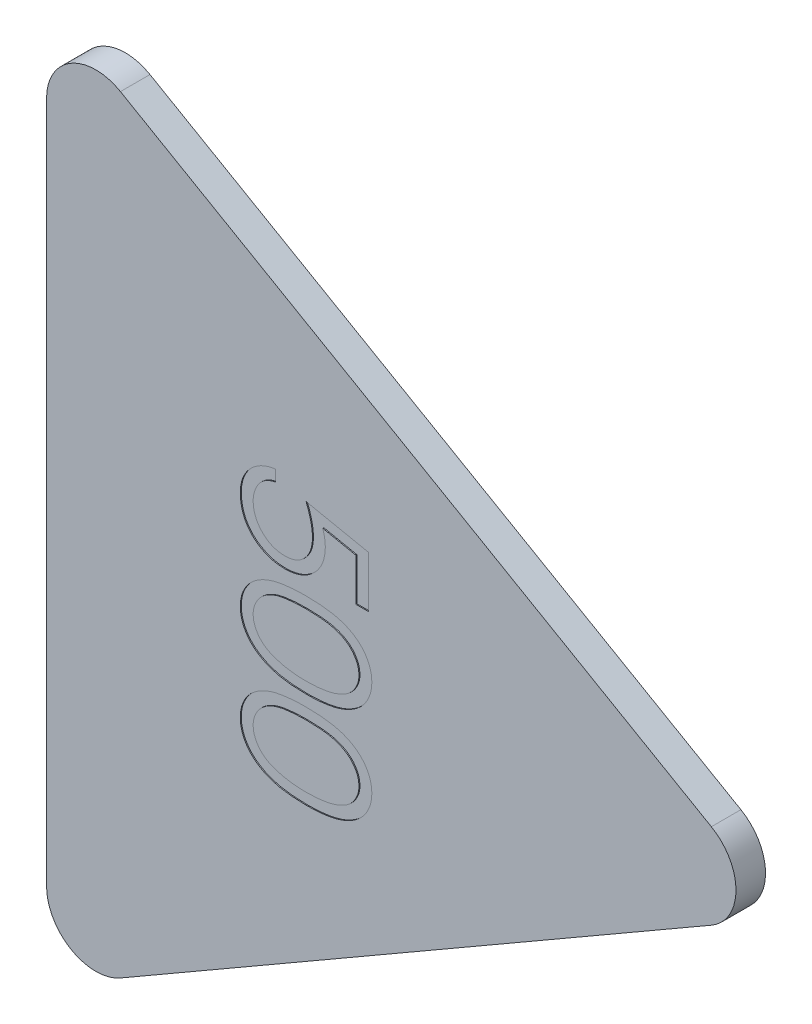
from build123d import *

# Parameters (mm, degrees)
BOSS_EXTRUDE1_DEPTH = 3
CUT_EXTRUDE1_DEPTH  = 0.1


with BuildPart() as part:
    # Sketch1 → Boss-Extrude1 (new body)
    with BuildSketch(Plane(origin=(0, 0, 0), x_dir=(0, 1, 0), z_dir=(0, 0, 1))):
        with BuildLine():
            Line((4.330127019, -42.5), (38.97114317, 17.5))
            ThreePointArc((38.97114317, 17.5), (38.97114317, 22.5), (34.641016151, 25))
            Line((34.641016151, 25), (-34.641016151, 25))
            ThreePointArc((-34.641016151, 25), (-38.97114317, 22.5), (-38.97114317, 17.5))
            Line((-38.97114317, 17.5), (-4.330127019, -42.5))
            ThreePointArc((-4.330127019, -42.5), (0, -45), (4.330127019, -42.5))
        make_face()
    extrude(amount=BOSS_EXTRUDE1_DEPTH)

    # Sketch3 → Cut-Extrude1 (cut)
    # profile 1 of 3: a face of its own
    with BuildSketch(Plane(origin=(0, 0, 3), x_dir=(0, -1, 0), z_dir=(0, 0, 1))):
        with BuildLine():
            Line((-5.840961891, 7.698344684), (-5.840961891, 6.395780582))
            Line((-5.840961891, 6.395780582), (-10.158249551, 6.395780582))
            Line((-10.158249551, 6.395780582), (-10.845148589, 3.055415998))
            add(Edge.make_bspline(
                [(-10.845148589, 3.055415998), (-10.710688702, 3.09253727), (-10.450193938, 3.164453864), (-10.065711013, 3.244303374), (-9.700705018, 3.292437985), (-9.463848674, 3.299010454), (-9.349235128, 3.302190838)],
                knots=[0, 0, 0, 0, 1.100273476, 2.13160584, 3.095893838, 4, 4, 4, 4], degree=3))
            add(Edge.make_bspline(
                [(-9.349235128, 3.302190838), (-9.207416987, 3.2991213), (-8.928567088, 3.293085821), (-8.520574337, 3.235130825), (-8.131109268, 3.143908849), (-7.760986382, 3.016471527), (-7.409520955, 2.853513352), (-7.07994666, 2.649950712), (-6.767316519, 2.412158338), (-6.477239107, 2.138763581), (-6.214079474, 1.837876571), (-5.982700026, 1.514360868), (-5.786167198, 1.171360494), (-5.628103888, 0.805598285), (-5.501886446, 0.421117928), (-5.417877779, 0.013873986), (-5.36193715, -0.412294907), (-5.355687348, -0.703685775), (-5.352500352, -0.852276309)],
                knots=[0, 0, 0, 0, 1.052922333, 2.070308379, 3.05430497, 4.020497103, 4.973039431, 5.925935799, 6.892292201, 7.88610001, 8.88166317, 9.857072816, 10.836096531, 11.812156883, 12.81219415, 13.836441305, 14.89672472, 16, 16, 16, 16], degree=3))
            add(Edge.make_bspline(
                [(-5.352500352, -0.852276309), (-5.354913625, -0.955771223), (-5.359707558, -1.161362407), (-5.384086434, -1.466685649), (-5.431024603, -1.765545072), (-5.494044631, -2.057980322), (-5.575841404, -2.343437759), (-5.674861686, -2.622734446), (-5.796041557, -2.894132019), (-5.928961119, -3.160198452), (-6.07862691, -3.41491875), (-6.244737494, -3.653130787), (-6.420235134, -3.878408036), (-6.609071018, -4.088334439), (-6.813000343, -4.281530533), (-7.029553366, -4.459142868), (-7.257002089, -4.624175124), (-7.498865397, -4.769928289), (-7.749753835, -4.904051016), (-8.013290509, -5.014082137), (-8.283476479, -5.112454625), (-8.564200456, -5.190866339), (-8.854826576, -5.252307323), (-9.155833904, -5.294038074), (-9.465643764, -5.324432575), (-9.675647381, -5.326335242), (-9.781727115, -5.327296341)],
                knots=[0, 0, 0, 0, 1.056347294, 2.098418968, 3.122841568, 4.141288669, 5.149314143, 6.15115421, 7.162517403, 8.180376062, 9.185164535, 10.17417709, 11.141909838, 12.097768115, 13.052685741, 14.0056014, 14.954263652, 15.917497458, 16.885230207, 17.854509472, 18.828990115, 19.81800267, 20.826176721, 21.857883937, 22.917946725, 24, 24, 24, 24], degree=3))
            add(Edge.make_bspline(
                [(-9.781727115, -5.327296341), (-9.908270571, -5.324789586), (-10.157229871, -5.319857842), (-10.521975928, -5.268265053), (-10.872911783, -5.194373128), (-11.207212436, -5.083207234), (-11.527873879, -4.943916193), (-11.830579169, -4.7678718), (-12.123062985, -4.568376195), (-12.393435233, -4.3329532), (-12.64437313, -4.075630582), (-12.869005319, -3.796384284), (-13.069061441, -3.499823166), (-13.241337837, -3.184507007), (-13.3882878, -2.851264337), (-13.503730757, -2.498846591), (-13.596906502, -2.129095148), (-13.6363252, -1.874538125), (-13.656346506, -1.745245059)],
                knots=[0, 0, 0, 0, 1.0467383, 2.05933395, 3.04377827, 4.011590433, 4.970194871, 5.932262533, 6.905835911, 7.896367577, 8.894135286, 9.877477877, 10.858688626, 11.851381753, 12.8477658, 13.868841284, 14.917554742, 16, 16, 16, 16], degree=3))
            Line((-13.656346506, -1.745245059), (-12.516602916, -1.745245059))
            add(Edge.make_bspline(
                [(-12.516602916, -1.745245059), (-12.488559294, -1.866353901), (-12.434657894, -2.09913182), (-12.316345606, -2.42617983), (-12.171689429, -2.71762387), (-11.999679365, -2.977319215), (-11.79448354, -3.203774719), (-11.560333898, -3.405585201), (-11.297815016, -3.587649242), (-11.006102441, -3.73940614), (-10.698352124, -3.868832759), (-10.376253962, -3.955017481), (-10.048578191, -4.015617864), (-9.826950962, -4.021683967), (-9.715581282, -4.024732239)],
                knots=[0, 0, 0, 0, 1.136247022, 2.183929868, 3.172523383, 4.106158343, 5.02341133, 5.958108904, 6.928429099, 7.938127109, 8.96079061, 9.975095812, 10.982467395, 12, 12, 12, 12], degree=3))
            add(Edge.make_bspline(
                [(-9.715581282, -4.024732239), (-9.606874926, -4.021753988), (-9.392831223, -4.015889786), (-9.077829905, -3.970753943), (-8.773708905, -3.901239327), (-8.483469067, -3.79720871), (-8.202031481, -3.67077216), (-7.936515228, -3.508520314), (-7.679239074, -3.321793961), (-7.438199847, -3.107865618), (-7.217439559, -2.87211844), (-7.022381634, -2.620014756), (-6.859905405, -2.351076484), (-6.722984496, -2.069959615), (-6.619013955, -1.773583136), (-6.544842394, -1.463336015), (-6.501288438, -1.138451944), (-6.495297013, -0.916857591), (-6.492243942, -0.80393897)],
                knots=[0, 0, 0, 0, 1.027316725, 2.022795036, 3.002884548, 3.971462791, 4.93288096, 5.914575861, 6.907176829, 7.935150275, 8.956128384, 9.956726525, 10.942570165, 11.921478529, 12.907843606, 13.90538589, 14.932640048, 16, 16, 16, 16], degree=3))
            add(Edge.make_bspline(
                [(-6.492243942, -0.80393897), (-6.494633282, -0.702064099), (-6.499310074, -0.502658536), (-6.537521001, -0.210924273), (-6.603985443, 0.065112195), (-6.696237808, 0.326783844), (-6.813366307, 0.574337478), (-6.956500069, 0.808028582), (-7.128325256, 1.024777062), (-7.324601537, 1.224684328), (-7.539623572, 1.409178588), (-7.777090866, 1.566455702), (-8.032034029, 1.698767632), (-8.301381433, 1.812951512), (-8.591539779, 1.894959931), (-8.896762988, 1.956529115), (-9.220347043, 1.99214486), (-9.44158354, 1.997086569), (-9.555304839, 1.999626736)],
                knots=[0, 0, 0, 0, 1.045622112, 2.046656509, 3.013763289, 3.955457236, 4.890082067, 5.820317437, 6.762574623, 7.722996705, 8.69280354, 9.665887285, 10.63943826, 11.638615906, 12.663482002, 13.728887084, 14.832589034, 16, 16, 16, 16], degree=3))
            add(Edge.make_bspline(
                [(-9.555304839, 1.999626736), (-9.653744095, 1.997520019), (-9.856996185, 1.993170184), (-10.168773299, 1.96114261), (-10.496403265, 1.909474313), (-10.838630149, 1.838404215), (-11.196481707, 1.745400022), (-11.569202761, 1.633950263), (-11.957576985, 1.500701867), (-12.2192613, 1.400073549), (-12.353782404, 1.348344684)],
                knots=[0, 0, 0, 0, 0.817624296, 1.688186739, 2.600797293, 3.572016777, 4.590301741, 5.671205678, 6.80286297, 8, 8, 8, 8], degree=3))
            Line((-12.353782404, 1.348344684), (-11.051218301, 7.698344684))
            Line((-11.051218301, 7.698344684), (-5.840961891, 7.698344684))
        make_face()
    # profile 2 of 3: a face of its own
    with BuildSketch(Plane(origin=(0, 0, 3), x_dir=(0, -1, 0), z_dir=(0, 0, 1))):
        with BuildLine():
            add(Edge.make_bspline(
                [(-4.04993625, 1.343256543), (-4.048746012, 1.546809922), (-4.046433959, 1.942215293), (-4.020713118, 2.518376708), (-3.977985447, 3.058889757), (-3.919429837, 3.563780311), (-3.848172023, 4.033178714), (-3.753047257, 4.465830547), (-3.644869373, 4.863738262), (-3.519493356, 5.22819941), (-3.378023378, 5.564124218), (-3.224047632, 5.877724234), (-3.051455378, 6.16852496), (-2.87011058, 6.441167799), (-2.672672492, 6.691189777), (-2.464759738, 6.922121724), (-2.238257501, 7.128626447), (-2.000865442, 7.316754459), (-1.750434271, 7.481671113), (-1.494102311, 7.626932765), (-1.230105213, 7.751029426), (-0.957722206, 7.848603293), (-0.679401496, 7.929196937), (-0.39417014, 7.984311119), (-0.101557191, 8.018989044), (0.095951158, 8.022304352), (0.196117436, 8.02398571)],
                knots=[0, 0, 0, 0, 1.646270934, 3.197905019, 4.663502075, 6.030701355, 7.308322542, 8.50163776, 9.611534131, 10.641858119, 11.616356847, 12.558055219, 13.465016945, 14.349605745, 15.204443733, 16.039544428, 16.859896111, 17.680448484, 18.487036065, 19.28249412, 20.06191084, 20.843045899, 21.620316918, 22.403196591, 23.190181807, 24, 24, 24, 24], degree=3))
            add(Edge.make_bspline(
                [(0.196117436, 8.02398571), (0.297120458, 8.022215638), (0.49798369, 8.018695521), (0.794947338, 7.984862929), (1.085050469, 7.928724854), (1.367056286, 7.849183032), (1.643281237, 7.750501577), (1.911564773, 7.626814038), (2.173573327, 7.482836433), (2.425143227, 7.313658364), (2.66903626, 7.125036962), (2.899261726, 6.911812421), (3.11584058, 6.676137725), (3.321490974, 6.420534391), (3.510378427, 6.14009994), (3.690259167, 5.839711884), (3.851266268, 5.514117032), (4.00633209, 5.168747906), (4.140179156, 4.794048344), (4.260888103, 4.392130499), (4.35842036, 3.958247021), (4.439661434, 3.494674359), (4.502598628, 2.999710063), (4.548437072, 2.474415147), (4.572650838, 1.918444015), (4.577210868, 1.538322676), (4.57955093, 1.343256543)],
                knots=[0, 0, 0, 0, 0.810914788, 1.612654377, 2.396697861, 3.181598691, 3.963628158, 4.749916497, 5.551656086, 6.361998678, 7.18212741, 8.025565596, 8.878627764, 9.750805457, 10.657531673, 11.591944965, 12.560506719, 13.57287815, 14.630710178, 15.753379473, 16.941251878, 18.199788006, 19.531962791, 20.947069417, 22.433333509, 24, 24, 24, 24], degree=3))
            add(Edge.make_bspline(
                [(4.57955093, 1.343256543), (4.577186609, 1.14904122), (4.572579826, 0.770620583), (4.548708518, 0.217151044), (4.501687199, -0.305356141), (4.442868099, -0.798154105), (4.361403176, -1.259191751), (4.261235859, -1.690064464), (4.150018973, -2.092632952), (4.01273272, -2.463599269), (3.862471, -2.808138377), (3.698985002, -3.129873458), (3.52383449, -3.431648292), (3.333012473, -3.711047374), (3.129618659, -3.970049929), (2.909299825, -4.20408416), (2.678266559, -4.41878917), (2.433655793, -4.609839361), (2.17816245, -4.777061366), (1.9170538, -4.926608766), (1.645696952, -5.047195974), (1.37024138, -5.150737408), (1.086747023, -5.229841905), (0.795567263, -5.284538467), (0.498183207, -5.322899174), (0.297154671, -5.325825544), (0.196117436, -5.327296341)],
                knots=[0, 0, 0, 0, 1.561518951, 3.042555995, 4.452378317, 5.7783523, 7.031515105, 8.214008947, 9.334062868, 10.386615937, 11.391082383, 12.354592575, 13.286541444, 14.194233754, 15.072674879, 15.931287219, 16.775624067, 17.606195743, 18.42308326, 19.229000347, 20.022332153, 20.807536673, 21.593273796, 22.3848459, 23.188221202, 24, 24, 24, 24], degree=3))
            add(Edge.make_bspline(
                [(0.196117436, -5.327296341), (0.095953937, -5.325604137), (-0.101548933, -5.322267441), (-0.39420202, -5.287746187), (-0.678255457, -5.232245361), (-0.955110936, -5.154533683), (-1.226188862, -5.059411277), (-1.487795388, -4.935482197), (-1.742839269, -4.792755718), (-1.990640058, -4.630212332), (-2.226541328, -4.443987938), (-2.451870553, -4.238014662), (-2.660967051, -4.00715257), (-2.855582198, -3.755046963), (-3.040545318, -3.484017198), (-3.210686758, -3.190362816), (-3.368061, -2.875248201), (-3.511910238, -2.536637496), (-3.639449674, -2.169589615), (-3.7521085, -1.769905453), (-3.841059872, -1.334057288), (-3.917198024, -0.865545699), (-3.978609357, -0.362357437), (-4.020535051, 0.175780672), (-4.046447823, 0.748533288), (-4.048752222, 1.141397897), (-4.04993625, 1.343256543)],
                knots=[0, 0, 0, 0, 0.810891512, 1.598919785, 2.382837074, 3.152667961, 3.926044502, 4.706494248, 5.493654104, 6.291793342, 7.103789334, 7.925228297, 8.761435821, 9.622817696, 10.50288917, 11.416980706, 12.369136599, 13.353924996, 14.394355917, 15.514179734, 16.714354668, 17.994756427, 19.357759367, 20.818452758, 22.365282078, 24, 24, 24, 24], degree=3))
        make_face()
        with BuildLine():
            add(Edge.make_bspline(
                [(-2.91019266, 1.348344684), (-2.909759238, 1.178713691), (-2.90891805, 0.849493243), (-2.886942694, 0.371090553), (-2.857006138, -0.075116068), (-2.818393431, -0.489693186), (-2.761051303, -0.871237517), (-2.696800959, -1.222373225), (-2.618612177, -1.541242056), (-2.526101683, -1.830032112), (-2.420731246, -2.093644447), (-2.305684255, -2.338940284), (-2.182092489, -2.568817311), (-2.043774428, -2.78121069), (-1.893134056, -2.976813057), (-1.733573944, -3.159086477), (-1.559139139, -3.321635523), (-1.317825559, -3.516587254), (-0.99924978, -3.718042397), (-0.597855557, -3.893469637), (-0.185401463, -4.00371455), (0.094547359, -4.017734465), (0.234278494, -4.024732239)],
                knots=[0, 0, 0, 0, 1.459021318, 2.831673884, 4.118529203, 5.306027144, 6.411944654, 7.436330062, 8.375795394, 9.233974572, 10.042671642, 10.816086306, 11.563610507, 12.285937304, 12.993564865, 13.685989202, 14.367179055, 15.041617293, 16.353048772, 17.594441528, 18.799311195, 20, 20, 20, 20], degree=3))
            add(Edge.make_bspline(
                [(0.234278494, -4.024732239), (0.374913474, -4.018934577), (0.655893075, -4.007351223), (1.066407132, -3.895595805), (1.464934112, -3.726977762), (1.777252295, -3.527596814), (2.014860382, -3.337719732), (2.185102031, -3.175832294), (2.34135575, -2.994563861), (2.489554136, -2.798986416), (2.625477068, -2.585363402), (2.749077596, -2.354722058), (2.861865743, -2.106421898), (2.926124281, -1.933085987), (2.958978013, -1.844463809)],
                knots=[0, 0, 0, 0, 1.353760809, 2.704726607, 4.075137775, 5.516104923, 6.260822281, 7.007110065, 7.778089737, 8.566572457, 9.372053459, 10.217411131, 11.088608312, 12, 12, 12, 12], degree=3))
            add(Edge.make_bspline(
                [(2.958978013, -1.844463809), (2.997265856, -1.731144469), (3.075006598, -1.50105761), (3.175197893, -1.144138073), (3.254102627, -0.769659472), (3.325089697, -0.379859763), (3.373542214, 0.028135724), (3.412541423, 0.453064603), (3.435512772, 0.89524726), (3.438360298, 1.195674799), (3.43980734, 1.348344684)],
                knots=[0, 0, 0, 0, 0.884706709, 1.796334032, 2.740027952, 3.714592787, 4.726048262, 5.777819803, 6.87074269, 8, 8, 8, 8], degree=3))
            add(Edge.make_bspline(
                [(3.43980734, 1.348344684), (3.437810939, 1.500989876), (3.433905552, 1.799596502), (3.418977654, 2.236905329), (3.380429255, 2.652259776), (3.337615309, 3.047449206), (3.27448825, 3.420286018), (3.206424208, 3.773891412), (3.114979809, 4.103884673), (3.017299483, 4.415432298), (2.905501762, 4.704994673), (2.782436097, 4.973921841), (2.651002859, 5.223512128), (2.508246729, 5.453080744), (2.355862393, 5.663655971), (2.189827858, 5.851015786), (2.016729133, 6.02096707), (1.774278202, 6.214959821), (1.456871493, 6.412759402), (1.061917287, 6.594789445), (0.650906664, 6.699322392), (0.373054416, 6.714060514), (0.234278494, 6.721421607)],
                knots=[0, 0, 0, 0, 1.31362396, 2.569729283, 3.763502607, 4.902122613, 5.988968491, 7.01645872, 7.998833611, 8.933434873, 9.825090667, 10.667526885, 11.477055099, 12.250526234, 12.991942729, 13.710640831, 14.402115721, 15.076753259, 16.378508321, 17.609869233, 18.806226677, 20, 20, 20, 20], degree=3))
            add(Edge.make_bspline(
                [(0.234278494, 6.721421607), (0.093814345, 6.714050358), (-0.187369843, 6.699294431), (-0.602652422, 6.595178911), (-1.000722498, 6.413703291), (-1.317289863, 6.214304683), (-1.559909889, 6.024391381), (-1.730752805, 5.859703391), (-1.890940344, 5.679558411), (-2.038505998, 5.482157177), (-2.176715683, 5.270011415), (-2.303646786, 5.041452183), (-2.418009668, 4.795321233), (-2.523544985, 4.53182731), (-2.616337673, 4.243062169), (-2.692878625, 3.924586107), (-2.763588789, 3.574567242), (-2.813645908, 3.190956456), (-2.858145822, 2.7762755), (-2.886743856, 2.328954945), (-2.908991561, 1.849749908), (-2.909784275, 1.518827247), (-2.91019266, 1.348344684)],
                knots=[0, 0, 0, 0, 1.207732386, 2.417664972, 3.655092373, 4.956220595, 5.625982001, 6.301752483, 6.994047911, 7.697131622, 8.419323945, 9.170223765, 9.943494443, 10.752040957, 11.610060368, 12.549350801, 13.567764191, 14.679664412, 15.874934091, 17.154273443, 18.533957287, 20, 20, 20, 20], degree=3))
        make_face(mode=Mode.SUBTRACT)
    # profile 3 of 3: a face of its own
    with BuildSketch(Plane(origin=(0, 0, 3), x_dir=(0, -1, 0), z_dir=(0, 0, 1))):
        with BuildLine():
            add(Edge.make_bspline(
                [(5.71929452, 1.343256543), (5.720484757, 1.546809922), (5.72279681, 1.942215293), (5.748517652, 2.518376708), (5.791245322, 3.058889757), (5.849800932, 3.563780311), (5.921058746, 4.033178714), (6.016183512, 4.465830547), (6.124361396, 4.863738262), (6.249737414, 5.22819941), (6.391207391, 5.564124218), (6.545183137, 5.877724234), (6.717775391, 6.16852496), (6.899120189, 6.441167799), (7.096558278, 6.691189777), (7.304471032, 6.922121724), (7.530973268, 7.128626447), (7.768365327, 7.316754459), (8.018796498, 7.481671113), (8.275128458, 7.626932765), (8.539125556, 7.751029426), (8.811508563, 7.848603293), (9.089829273, 7.929196937), (9.375060629, 7.984311119), (9.667673578, 8.018989044), (9.865181927, 8.022304352), (9.965348205, 8.02398571)],
                knots=[0, 0, 0, 0, 1.646270934, 3.197905019, 4.663502075, 6.030701355, 7.308322542, 8.50163776, 9.611534131, 10.641858119, 11.616356847, 12.558055219, 13.465016945, 14.349605745, 15.204443733, 16.039544428, 16.859896111, 17.680448484, 18.487036065, 19.28249412, 20.06191084, 20.843045899, 21.620316918, 22.403196591, 23.190181807, 24, 24, 24, 24], degree=3))
            add(Edge.make_bspline(
                [(9.965348205, 8.02398571), (10.066351227, 8.022215638), (10.26721446, 8.018695521), (10.564178107, 7.984862929), (10.854281238, 7.928724854), (11.136287055, 7.849183032), (11.412512006, 7.750501577), (11.680795543, 7.626814038), (11.942804096, 7.482836433), (12.194373996, 7.313658364), (12.438267029, 7.125036962), (12.668492495, 6.911812421), (12.885071349, 6.676137725), (13.090721743, 6.420534391), (13.279609196, 6.14009994), (13.459489936, 5.839711884), (13.620497037, 5.514117032), (13.775562859, 5.168747906), (13.909409925, 4.794048344), (14.030118872, 4.392130499), (14.12765113, 3.958247021), (14.208892203, 3.494674359), (14.271829397, 2.999710063), (14.317667841, 2.474415147), (14.341881607, 1.918444015), (14.346441637, 1.538322676), (14.348781699, 1.343256543)],
                knots=[0, 0, 0, 0, 0.810914788, 1.612654377, 2.396697861, 3.181598691, 3.963628158, 4.749916497, 5.551656086, 6.361998678, 7.18212741, 8.025565596, 8.878627764, 9.750805457, 10.657531673, 11.591944965, 12.560506719, 13.57287815, 14.630710178, 15.753379473, 16.941251878, 18.199788006, 19.531962791, 20.947069417, 22.433333509, 24, 24, 24, 24], degree=3))
            add(Edge.make_bspline(
                [(14.348781699, 1.343256543), (14.346417378, 1.14904122), (14.341810595, 0.770620583), (14.317939287, 0.217151044), (14.270917969, -0.305356141), (14.212098868, -0.798154105), (14.130633945, -1.259191751), (14.030466628, -1.690064464), (13.919249742, -2.092632952), (13.781963489, -2.463599269), (13.631701769, -2.808138377), (13.468215771, -3.129873458), (13.293065259, -3.431648292), (13.102243242, -3.711047374), (12.898849428, -3.970049929), (12.678530595, -4.20408416), (12.447497329, -4.41878917), (12.202886563, -4.609839361), (11.94739322, -4.777061366), (11.686284569, -4.926608766), (11.414927721, -5.047195974), (11.13947215, -5.150737408), (10.855977793, -5.229841905), (10.564798032, -5.284538467), (10.267413976, -5.322899174), (10.06638544, -5.325825544), (9.965348205, -5.327296341)],
                knots=[0, 0, 0, 0, 1.561518951, 3.042555995, 4.452378317, 5.7783523, 7.031515105, 8.214008947, 9.334062868, 10.386615937, 11.391082383, 12.354592575, 13.286541444, 14.194233754, 15.072674879, 15.931287219, 16.775624067, 17.606195743, 18.42308326, 19.229000347, 20.022332153, 20.807536673, 21.593273796, 22.3848459, 23.188221202, 24, 24, 24, 24], degree=3))
            add(Edge.make_bspline(
                [(9.965348205, -5.327296341), (9.865184706, -5.325604137), (9.667681836, -5.322267441), (9.37502875, -5.287746187), (9.090975312, -5.232245361), (8.814119833, -5.154533683), (8.543041907, -5.059411277), (8.281435381, -4.935482197), (8.0263915, -4.792755718), (7.778590711, -4.630212332), (7.542689441, -4.443987938), (7.317360216, -4.238014662), (7.108263718, -4.00715257), (6.913648571, -3.755046963), (6.728685451, -3.484017198), (6.558544011, -3.190362816), (6.401169769, -2.875248201), (6.257320532, -2.536637496), (6.129781095, -2.169589615), (6.017122269, -1.769905453), (5.928170897, -1.334057288), (5.852032745, -0.865545699), (5.790621412, -0.362357437), (5.748695718, 0.175780672), (5.722782946, 0.748533288), (5.720478548, 1.141397897), (5.71929452, 1.343256543)],
                knots=[0, 0, 0, 0, 0.810891512, 1.598919785, 2.382837074, 3.152667961, 3.926044502, 4.706494248, 5.493654104, 6.291793342, 7.103789334, 7.925228297, 8.761435821, 9.622817696, 10.50288917, 11.416980706, 12.369136599, 13.353924996, 14.394355917, 15.514179734, 16.714354668, 17.994756427, 19.357759367, 20.818452758, 22.365282078, 24, 24, 24, 24], degree=3))
        make_face()
        with BuildLine():
            add(Edge.make_bspline(
                [(6.859038109, 1.348344684), (6.859471532, 1.178713691), (6.860312719, 0.849493243), (6.882288075, 0.371090553), (6.912224631, -0.075116068), (6.950837338, -0.489693186), (7.008179466, -0.871237517), (7.07242981, -1.222373225), (7.150618593, -1.541242056), (7.243129086, -1.830032112), (7.348499523, -2.093644447), (7.463546514, -2.338940284), (7.58713828, -2.568817311), (7.725456341, -2.78121069), (7.876096713, -2.976813057), (8.035656825, -3.159086477), (8.210091631, -3.321635523), (8.451405211, -3.516587254), (8.769980989, -3.718042397), (9.171375213, -3.893469637), (9.583829306, -4.00371455), (9.863778128, -4.017734465), (10.003509263, -4.024732239)],
                knots=[0, 0, 0, 0, 1.459021318, 2.831673884, 4.118529203, 5.306027144, 6.411944654, 7.436330062, 8.375795394, 9.233974572, 10.042671642, 10.816086306, 11.563610507, 12.285937304, 12.993564865, 13.685989202, 14.367179055, 15.041617293, 16.353048772, 17.594441528, 18.799311195, 20, 20, 20, 20], degree=3))
            add(Edge.make_bspline(
                [(10.003509263, -4.024732239), (10.144144243, -4.018934577), (10.425123844, -4.007351223), (10.835637901, -3.895595805), (11.234164881, -3.726977762), (11.546483064, -3.527596814), (11.784091151, -3.337719732), (11.954332801, -3.175832294), (12.110586519, -2.994563861), (12.258784905, -2.798986416), (12.394707837, -2.585363402), (12.518308365, -2.354722058), (12.631096512, -2.106421898), (12.69535505, -1.933085987), (12.728208782, -1.844463809)],
                knots=[0, 0, 0, 0, 1.353760809, 2.704726607, 4.075137775, 5.516104923, 6.260822281, 7.007110065, 7.778089737, 8.566572457, 9.372053459, 10.217411131, 11.088608312, 12, 12, 12, 12], degree=3))
            add(Edge.make_bspline(
                [(12.728208782, -1.844463809), (12.766496626, -1.731144469), (12.844237367, -1.50105761), (12.944428662, -1.144138073), (13.023333397, -0.769659472), (13.094320467, -0.379859763), (13.142772984, 0.028135724), (13.181772192, 0.453064603), (13.204743542, 0.89524726), (13.207591067, 1.195674799), (13.209038109, 1.348344684)],
                knots=[0, 0, 0, 0, 0.884706709, 1.796334032, 2.740027952, 3.714592787, 4.726048262, 5.777819803, 6.87074269, 8, 8, 8, 8], degree=3))
            add(Edge.make_bspline(
                [(13.209038109, 1.348344684), (13.207041708, 1.500989876), (13.203136321, 1.799596502), (13.188208423, 2.236905329), (13.149660024, 2.652259776), (13.106846079, 3.047449206), (13.043719019, 3.420286018), (12.975654977, 3.773891412), (12.884210578, 4.103884673), (12.786530252, 4.415432298), (12.674732531, 4.704994673), (12.551666867, 4.973921841), (12.420233628, 5.223512128), (12.277477498, 5.453080744), (12.125093162, 5.663655971), (11.959058627, 5.851015786), (11.785959903, 6.02096707), (11.543508971, 6.214959821), (11.226102262, 6.412759402), (10.831148056, 6.594789445), (10.420137433, 6.699322392), (10.142285185, 6.714060514), (10.003509263, 6.721421607)],
                knots=[0, 0, 0, 0, 1.31362396, 2.569729283, 3.763502607, 4.902122613, 5.988968491, 7.01645872, 7.998833611, 8.933434873, 9.825090667, 10.667526885, 11.477055099, 12.250526234, 12.991942729, 13.710640831, 14.402115721, 15.076753259, 16.378508321, 17.609869233, 18.806226677, 20, 20, 20, 20], degree=3))
            add(Edge.make_bspline(
                [(10.003509263, 6.721421607), (9.863045115, 6.714050358), (9.581860926, 6.699294431), (9.166578347, 6.595178911), (8.768508271, 6.413703291), (8.451940906, 6.214304683), (8.209320881, 6.024391381), (8.038477965, 5.859703391), (7.878290426, 5.679558411), (7.730724771, 5.482157177), (7.592515086, 5.270011415), (7.465583983, 5.041452183), (7.351221101, 4.795321233), (7.245685784, 4.53182731), (7.152893096, 4.243062169), (7.076352144, 3.924586107), (7.00564198, 3.574567242), (6.955584861, 3.190956456), (6.911084947, 2.7762755), (6.882486913, 2.328954945), (6.860239208, 1.849749908), (6.859446494, 1.518827247), (6.859038109, 1.348344684)],
                knots=[0, 0, 0, 0, 1.207732386, 2.417664972, 3.655092373, 4.956220595, 5.625982001, 6.301752483, 6.994047911, 7.697131622, 8.419323945, 9.170223765, 9.943494443, 10.752040957, 11.610060368, 12.549350801, 13.567764191, 14.679664412, 15.874934091, 17.154273443, 18.533957287, 20, 20, 20, 20], degree=3))
        make_face(mode=Mode.SUBTRACT)
    extrude(amount=-CUT_EXTRUDE1_DEPTH, mode=Mode.SUBTRACT)


solid = part.part
